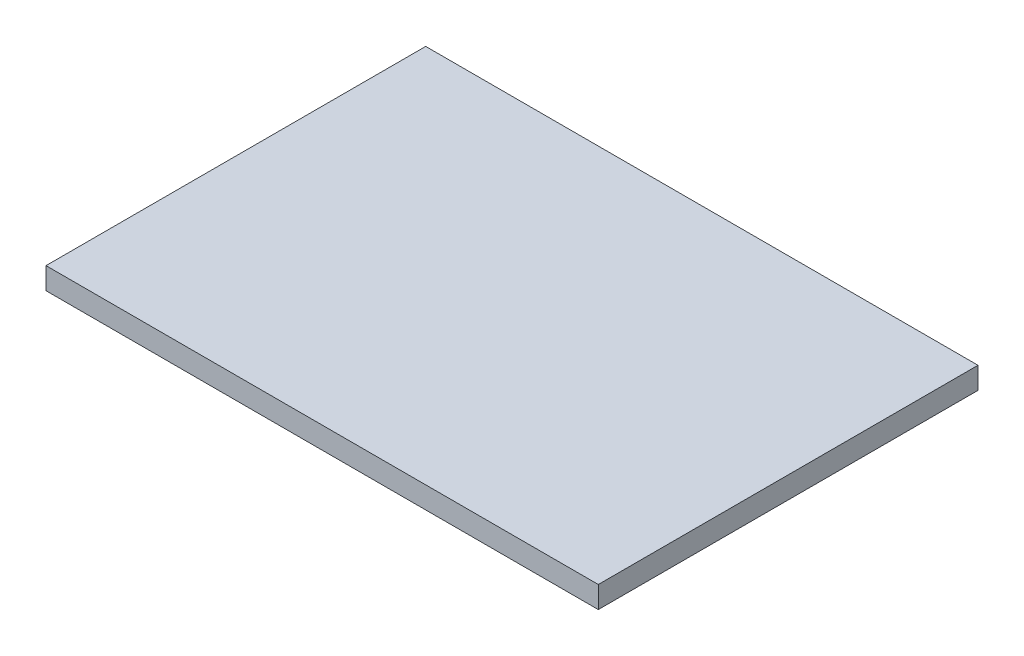
from build123d import *

# Parameters (mm, degrees)
SKETCH1_W           = 812.8
SKETCH1_H           = 558.8
BOSS_EXTRUDE1_DEPTH = 32


with BuildPart() as part:
    # Sketch1 → Boss-Extrude1 (new body)
    with BuildSketch(Plane(origin=(0, 0, 0), x_dir=(1, 0, 0), z_dir=(0, 1, 0))):
        Rectangle(SKETCH1_W, SKETCH1_H)
    extrude(amount=BOSS_EXTRUDE1_DEPTH)


solid = part.part
